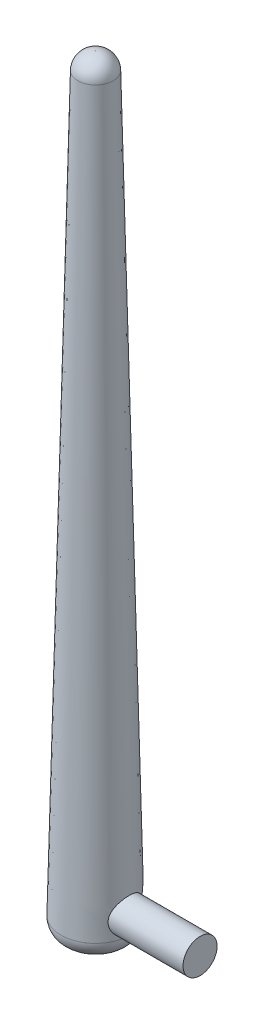
from build123d import *

# Parameters (mm, degrees)
FILLET1_R           = 2.5
SKETCH2_R           = 2.443196487
BOSS_EXTRUDE1_DEPTH = 15


with BuildPart() as part:
    # Sketch1 → Revolve1 (revolve)
    with BuildSketch(Plane.XY, mode=Mode.PRIVATE) as revolve1_sk:
        Polygon((0, 0), (0, 110), (2.5, 110), (5, 0), align=None)
    revolve(revolve1_sk.sketch.rotate(Axis((0, 0, 0), (0, 1, 0)), 90), axis=Axis((0, 0, 0), (0, 1, 0)))

    # Fillet1
    fillet1_edges = [part.edges().sort_by_distance(p)[0] for p in [
        (0, 110, 2.5),
        (0, 0, 5),
    ]]
    fillet(fillet1_edges, radius=FILLET1_R)

    # Sketch2 → Boss-Extrude1 (add)
    with BuildSketch(Plane(origin=(0, 0, 0), x_dir=(0, 0, -1), z_dir=(1, 0, 0))):
        with Locations(Location((0, 5, 0), (0, 0, 269.999999999))):
            Circle(SKETCH2_R)
    extrude(amount=BOSS_EXTRUDE1_DEPTH)


solid = part.part
